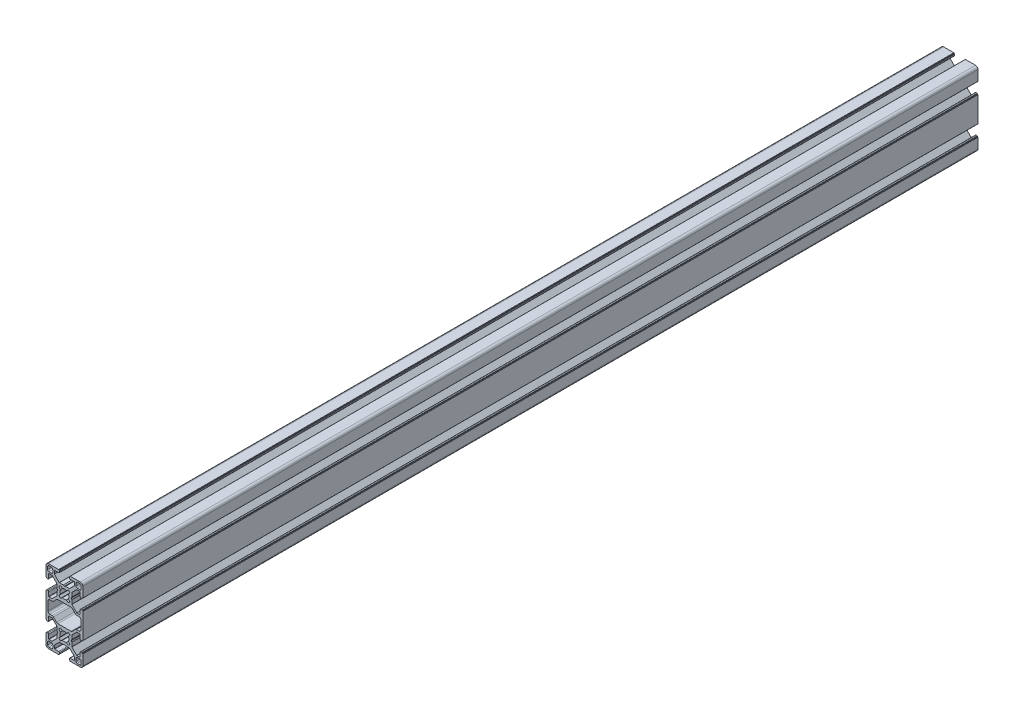
from build123d import *

# Parameters (mm, degrees)
EXTRUDE1_DEPTH = 728.95


with BuildPart() as part:
    # Sketch1 → Extrude1 (new body)
    with BuildSketch(Plane.XY):
        with BuildLine():
            Line((4.117156145, -21), (0.899999648, -21))
            Line((0.899999648, -21), (0.101934004, -20.53923672))
            ThreePointArc((0.101934004, -20.53923672), (0, -20.511923593), (-0.101934004, -20.53923672))
            Line((-0.101934004, -20.53923672), (-0.899999648, -21))
            Line((-0.899999648, -21), (-4.117156145, -21))
            ThreePointArc((-4.117156145, -21), (-4.193692724, -21.015224069), (-4.258577305, -21.058578552))
            Line((-4.258577305, -21.058578552), (-8.191421308, -24.991421554))
            ThreePointArc((-8.191421308, -24.991421554), (-8.234775894, -25.056306263), (-8.25, -25.132843))
            Line((-8.25, -25.132843), (-8.25, -27.6))
            ThreePointArc((-8.25, -27.6), (-8.191421356, -27.741421356), (-8.05, -27.8))
            Line((-8.05, -27.8), (-4.65, -27.8))
            ThreePointArc((-4.65, -27.8), (-4.225735931, -27.975735931), (-4.05, -28.4))
            Line((-4.05, -28.4), (-4.05, -29.3))
            ThreePointArc((-4.05, -29.3), (-4.108578644, -29.441421356), (-4.25, -29.5))
            Line((-4.25, -29.5), (-4.35, -29.5))
            ThreePointArc((-4.35, -29.5), (-4.491421356, -29.558578644), (-4.55, -29.7))
            Line((-4.55, -29.7), (-4.55, -29.8))
            ThreePointArc((-4.55, -29.8), (-4.608578644, -29.941421356), (-4.75, -30))
            Line((-4.75, -30), (-13, -30))
            ThreePointArc((-13, -30), (-14.414213562, -29.414213562), (-15, -28))
            Line((-15, -28), (-15, -19.750000125))
            ThreePointArc((-15, -19.750000125), (-14.941421356, -19.608578769), (-14.8, -19.550000125))
            Line((-14.8, -19.550000125), (-14.700000334, -19.550000125))
            ThreePointArc((-14.700000334, -19.550000125), (-14.558578978, -19.491421481), (-14.500000334, -19.350000125))
            Line((-14.500000334, -19.350000125), (-14.500000334, -19.25))
            ThreePointArc((-14.500000334, -19.25), (-14.44142169, -19.108578644), (-14.300000334, -19.05))
            Line((-14.300000334, -19.05), (-13.400000821, -19.05))
            ThreePointArc((-13.400000821, -19.05), (-12.975736752, -19.225735931), (-12.800000821, -19.65))
            Line((-12.800000821, -19.65), (-12.800000821, -23.05))
            ThreePointArc((-12.800000821, -23.05), (-12.741422177, -23.191421356), (-12.600000821, -23.25))
            Line((-12.600000821, -23.25), (-10.132842821, -23.25))
            ThreePointArc((-10.132842821, -23.25), (-10.056306123, -23.234775902), (-9.991421447, -23.191421338))
            Line((-9.991421447, -23.191421338), (-6.063045884, -19.263044775))
            ThreePointArc((-6.063045884, -19.263044775), (-6.019691347, -19.198160112), (-6.004467258, -19.121623437))
            Line((-6.004467258, -19.121623437), (-6.004467258, -15.90000009))
            Line((-6.004467258, -15.90000009), (-5.542586948, -15.099999736))
            ThreePointArc((-5.542586948, -15.099999736), (-5.515792105, -15), (-5.542586948, -14.900000264))
            Line((-5.542586948, -14.900000264), (-6.004467258, -14.09999991))
            Line((-6.004467258, -14.09999991), (-6.004467258, -10.878376563))
            ThreePointArc((-6.004467258, -10.878376563), (-6.019691347, -10.801839888), (-6.063045884, -10.736955225))
            Line((-6.063045884, -10.736955225), (-9.991421447, -6.808578662))
            ThreePointArc((-9.991421447, -6.808578662), (-10.056306123, -6.765224098), (-10.132842821, -6.75))
            Line((-10.132842821, -6.75), (-12.600000821, -6.75))
            ThreePointArc((-12.600000821, -6.75), (-12.741422177, -6.808578644), (-12.800000821, -6.95))
            Line((-12.800000821, -6.95), (-12.800000821, -10.35))
            ThreePointArc((-12.800000821, -10.35), (-12.975736752, -10.774264069), (-13.400000821, -10.95))
            Line((-13.400000821, -10.95), (-14.300000334, -10.95))
            ThreePointArc((-14.300000334, -10.95), (-14.44142169, -10.891421356), (-14.500000334, -10.75))
            Line((-14.500000334, -10.75), (-14.500000334, -10.65))
            ThreePointArc((-14.500000334, -10.65), (-14.558578978, -10.508578644), (-14.700000334, -10.45))
            Line((-14.700000334, -10.45), (-14.8, -10.45))
            ThreePointArc((-14.8, -10.45), (-14.941421356, -10.391421356), (-15, -10.25))
            Line((-15, -10.25), (-15, 10.25))
            ThreePointArc((-15, 10.25), (-14.941421356, 10.391421356), (-14.8, 10.45))
            Line((-14.8, 10.45), (-14.700000334, 10.45))
            ThreePointArc((-14.700000334, 10.45), (-14.558578978, 10.508578644), (-14.500000334, 10.65))
            Line((-14.500000334, 10.65), (-14.500000334, 10.75))
            ThreePointArc((-14.500000334, 10.75), (-14.44142169, 10.891421356), (-14.300000334, 10.95))
            Line((-14.300000334, 10.95), (-13.400000821, 10.95))
            ThreePointArc((-13.400000821, 10.95), (-12.975736752, 10.774264069), (-12.800000821, 10.35))
            Line((-12.800000821, 10.35), (-12.800000821, 6.95))
            ThreePointArc((-12.800000821, 6.95), (-12.741422177, 6.808578644), (-12.600000821, 6.75))
            Line((-12.600000821, 6.75), (-10.132842821, 6.75))
            ThreePointArc((-10.132842821, 6.75), (-10.056306123, 6.765224098), (-9.991421447, 6.808578662))
            Line((-9.991421447, 6.808578662), (-6.063045884, 10.736955225))
            ThreePointArc((-6.063045884, 10.736955225), (-6.019691347, 10.801839888), (-6.004467258, 10.878376563))
            Line((-6.004467258, 10.878376563), (-6.004467258, 14.09999991))
            Line((-6.004467258, 14.09999991), (-5.542586948, 14.900000264))
            ThreePointArc((-5.542586948, 14.900000264), (-5.515792105, 15), (-5.542586948, 15.099999736))
            Line((-5.542586948, 15.099999736), (-6.004467258, 15.90000009))
            Line((-6.004467258, 15.90000009), (-6.004467258, 19.121623437))
            ThreePointArc((-6.004467258, 19.121623437), (-6.019691347, 19.198160112), (-6.063045884, 19.263044775))
            Line((-6.063045884, 19.263044775), (-9.991421447, 23.191421338))
            ThreePointArc((-9.991421447, 23.191421338), (-10.056306123, 23.234775902), (-10.132842821, 23.25))
            Line((-10.132842821, 23.25), (-12.600000821, 23.25))
            ThreePointArc((-12.600000821, 23.25), (-12.741422177, 23.191421356), (-12.800000821, 23.05))
            Line((-12.800000821, 23.05), (-12.800000821, 19.65))
            ThreePointArc((-12.800000821, 19.65), (-12.975736752, 19.225735931), (-13.400000821, 19.05))
            Line((-13.400000821, 19.05), (-14.300000334, 19.05))
            ThreePointArc((-14.300000334, 19.05), (-14.44142169, 19.108578644), (-14.500000334, 19.25))
            Line((-14.500000334, 19.25), (-14.500000334, 19.350000125))
            ThreePointArc((-14.500000334, 19.350000125), (-14.558578978, 19.491421481), (-14.700000334, 19.550000125))
            Line((-14.700000334, 19.550000125), (-14.8, 19.550000125))
            ThreePointArc((-14.8, 19.550000125), (-14.941421356, 19.608578769), (-15, 19.750000125))
            Line((-15, 19.750000125), (-15, 28))
            ThreePointArc((-15, 28), (-14.414213562, 29.414213562), (-13, 30))
            Line((-13, 30), (-4.75, 30))
            ThreePointArc((-4.75, 30), (-4.608578644, 29.941421356), (-4.55, 29.8))
            Line((-4.55, 29.8), (-4.55, 29.7))
            ThreePointArc((-4.55, 29.7), (-4.491421356, 29.558578644), (-4.35, 29.5))
            Line((-4.35, 29.5), (-4.25, 29.5))
            ThreePointArc((-4.25, 29.5), (-4.108578644, 29.441421356), (-4.05, 29.3))
            Line((-4.05, 29.3), (-4.05, 28.4))
            ThreePointArc((-4.05, 28.4), (-4.225735931, 27.975735931), (-4.65, 27.8))
            Line((-4.65, 27.8), (-8.05, 27.8))
            ThreePointArc((-8.05, 27.8), (-8.191421356, 27.741421356), (-8.25, 27.6))
            Line((-8.25, 27.6), (-8.25, 25.132843))
            ThreePointArc((-8.25, 25.132843), (-8.234775894, 25.056306263), (-8.191421308, 24.991421554))
            Line((-8.191421308, 24.991421554), (-4.258577305, 21.058578552))
            ThreePointArc((-4.258577305, 21.058578552), (-4.193692724, 21.015224069), (-4.117156145, 21))
            Line((-4.117156145, 21), (-0.899999648, 21))
            Line((-0.899999648, 21), (-0.101934004, 20.53923672))
            ThreePointArc((-0.101934004, 20.53923672), (0, 20.511923593), (0.101934004, 20.53923672))
            Line((0.101934004, 20.53923672), (0.899999648, 21))
            Line((0.899999648, 21), (4.117156145, 21))
            ThreePointArc((4.117156145, 21), (4.193692724, 21.015224069), (4.258577305, 21.058578552))
            Line((4.258577305, 21.058578552), (8.191421308, 24.991421554))
            ThreePointArc((8.191421308, 24.991421554), (8.234775894, 25.056306263), (8.25, 25.132843))
            Line((8.25, 25.132843), (8.25, 27.6))
            ThreePointArc((8.25, 27.6), (8.191421356, 27.741421356), (8.05, 27.8))
            Line((8.05, 27.8), (4.65, 27.8))
            ThreePointArc((4.65, 27.8), (4.225735931, 27.975735931), (4.05, 28.4))
            Line((4.05, 28.4), (4.05, 29.3))
            ThreePointArc((4.05, 29.3), (4.108578644, 29.441421356), (4.25, 29.5))
            Line((4.25, 29.5), (4.35, 29.5))
            ThreePointArc((4.35, 29.5), (4.491421356, 29.558578644), (4.55, 29.7))
            Line((4.55, 29.7), (4.55, 29.8))
            ThreePointArc((4.55, 29.8), (4.608578644, 29.941421356), (4.75, 30))
            Line((4.75, 30), (13, 30))
            ThreePointArc((13, 30), (14.414213562, 29.414213562), (15, 28))
            Line((15, 28), (15, 19.750000125))
            ThreePointArc((15, 19.750000125), (14.941421356, 19.608578769), (14.8, 19.550000125))
            Line((14.8, 19.550000125), (14.700000334, 19.550000125))
            ThreePointArc((14.700000334, 19.550000125), (14.558578978, 19.491421481), (14.500000334, 19.350000125))
            Line((14.500000334, 19.350000125), (14.500000334, 19.25))
            ThreePointArc((14.500000334, 19.25), (14.44142169, 19.108578644), (14.300000334, 19.05))
            Line((14.300000334, 19.05), (13.400000821, 19.05))
            ThreePointArc((13.400000821, 19.05), (12.975736752, 19.225735931), (12.800000821, 19.65))
            Line((12.800000821, 19.65), (12.800000821, 23.05))
            ThreePointArc((12.800000821, 23.05), (12.741422177, 23.191421356), (12.600000821, 23.25))
            Line((12.600000821, 23.25), (10.132842821, 23.25))
            ThreePointArc((10.132842821, 23.25), (10.056306123, 23.234775902), (9.991421447, 23.191421338))
            Line((9.991421447, 23.191421338), (6.063045884, 19.263044775))
            ThreePointArc((6.063045884, 19.263044775), (6.019691347, 19.198160112), (6.004467258, 19.121623437))
            Line((6.004467258, 19.121623437), (6.004467258, 15.90000009))
            Line((6.004467258, 15.90000009), (5.542586948, 15.099999736))
            ThreePointArc((5.542586948, 15.099999736), (5.515792105, 15), (5.542586948, 14.900000264))
            Line((5.542586948, 14.900000264), (6.004467258, 14.09999991))
            Line((6.004467258, 14.09999991), (6.004467258, 10.878376563))
            ThreePointArc((6.004467258, 10.878376563), (6.019691347, 10.801839888), (6.063045884, 10.736955225))
            Line((6.063045884, 10.736955225), (9.991421447, 6.808578662))
            ThreePointArc((9.991421447, 6.808578662), (10.056306123, 6.765224098), (10.132842821, 6.75))
            Line((10.132842821, 6.75), (12.600000821, 6.75))
            ThreePointArc((12.600000821, 6.75), (12.741422177, 6.808578644), (12.800000821, 6.95))
            Line((12.800000821, 6.95), (12.800000821, 10.35))
            ThreePointArc((12.800000821, 10.35), (12.975736752, 10.774264069), (13.400000821, 10.95))
            Line((13.400000821, 10.95), (14.300000334, 10.95))
            ThreePointArc((14.300000334, 10.95), (14.44142169, 10.891421356), (14.500000334, 10.75))
            Line((14.500000334, 10.75), (14.500000334, 10.65))
            ThreePointArc((14.500000334, 10.65), (14.558578978, 10.508578644), (14.700000334, 10.45))
            Line((14.700000334, 10.45), (14.8, 10.45))
            ThreePointArc((14.8, 10.45), (14.941421356, 10.391421356), (15, 10.25))
            Line((15, 10.25), (15, -10.25))
            ThreePointArc((15, -10.25), (14.941421356, -10.391421356), (14.8, -10.45))
            Line((14.8, -10.45), (14.700000334, -10.45))
            ThreePointArc((14.700000334, -10.45), (14.558578978, -10.508578644), (14.500000334, -10.65))
            Line((14.500000334, -10.65), (14.500000334, -10.75))
            ThreePointArc((14.500000334, -10.75), (14.44142169, -10.891421356), (14.300000334, -10.95))
            Line((14.300000334, -10.95), (13.400000821, -10.95))
            ThreePointArc((13.400000821, -10.95), (12.975736752, -10.774264069), (12.800000821, -10.35))
            Line((12.800000821, -10.35), (12.800000821, -6.95))
            ThreePointArc((12.800000821, -6.95), (12.741422177, -6.808578644), (12.600000821, -6.75))
            Line((12.600000821, -6.75), (10.132842821, -6.75))
            ThreePointArc((10.132842821, -6.75), (10.056306123, -6.765224098), (9.991421447, -6.808578662))
            Line((9.991421447, -6.808578662), (6.063045884, -10.736955225))
            ThreePointArc((6.063045884, -10.736955225), (6.019691347, -10.801839888), (6.004467258, -10.878376563))
            Line((6.004467258, -10.878376563), (6.004467258, -14.09999991))
            Line((6.004467258, -14.09999991), (5.542586948, -14.900000264))
            ThreePointArc((5.542586948, -14.900000264), (5.515792105, -15), (5.542586948, -15.099999736))
            Line((5.542586948, -15.099999736), (6.004467258, -15.90000009))
            Line((6.004467258, -15.90000009), (6.004467258, -19.121623437))
            ThreePointArc((6.004467258, -19.121623437), (6.019691347, -19.198160112), (6.063045884, -19.263044775))
            Line((6.063045884, -19.263044775), (9.991421447, -23.191421338))
            ThreePointArc((9.991421447, -23.191421338), (10.056306123, -23.234775902), (10.132842821, -23.25))
            Line((10.132842821, -23.25), (12.600000821, -23.25))
            ThreePointArc((12.600000821, -23.25), (12.741422177, -23.191421356), (12.800000821, -23.05))
            Line((12.800000821, -23.05), (12.800000821, -19.65))
            ThreePointArc((12.800000821, -19.65), (12.975736752, -19.225735931), (13.400000821, -19.05))
            Line((13.400000821, -19.05), (14.300000334, -19.05))
            ThreePointArc((14.300000334, -19.05), (14.44142169, -19.108578644), (14.500000334, -19.25))
            Line((14.500000334, -19.25), (14.500000334, -19.350000125))
            ThreePointArc((14.500000334, -19.350000125), (14.558578978, -19.491421481), (14.700000334, -19.550000125))
            Line((14.700000334, -19.550000125), (14.8, -19.550000125))
            ThreePointArc((14.8, -19.550000125), (14.941421356, -19.608578769), (15, -19.750000125))
            Line((15, -19.750000125), (15, -28))
            ThreePointArc((15, -28), (14.414213562, -29.414213562), (13, -30))
            Line((13, -30), (4.75, -30))
            ThreePointArc((4.75, -30), (4.608578644, -29.941421356), (4.55, -29.8))
            Line((4.55, -29.8), (4.55, -29.7))
            ThreePointArc((4.55, -29.7), (4.491421356, -29.558578644), (4.35, -29.5))
            Line((4.35, -29.5), (4.25, -29.5))
            ThreePointArc((4.25, -29.5), (4.108578644, -29.441421356), (4.05, -29.3))
            Line((4.05, -29.3), (4.05, -28.4))
            ThreePointArc((4.05, -28.4), (4.225735931, -27.975735931), (4.65, -27.8))
            Line((4.65, -27.8), (8.05, -27.8))
            ThreePointArc((8.05, -27.8), (8.191421356, -27.741421356), (8.25, -27.6))
            Line((8.25, -27.6), (8.25, -25.132843))
            ThreePointArc((8.25, -25.132843), (8.234775894, -25.056306263), (8.191421308, -24.991421554))
            Line((8.191421308, -24.991421554), (4.258577305, -21.058578552))
            ThreePointArc((4.258577305, -21.058578552), (4.193692724, -21.015224069), (4.117156145, -21))
        make_face()
        with BuildLine():
            Line((1.600130621, -18.280561232), (3.154670945, -19.505335862))
            ThreePointArc((3.154670945, -19.505335862), (3.897156783, -18.881001031), (4.518401855, -18.135928041))
            Line((4.518401855, -18.135928041), (3.28056155, -16.600129968))
            ThreePointArc((3.28056155, -16.600129968), (3.65, -15), (3.28056155, -13.399870032))
            Line((3.28056155, -13.399870032), (4.518401855, -11.864071959))
            ThreePointArc((4.518401855, -11.864071959), (3.897156783, -11.118998969), (3.154670945, -10.494664138))
            Line((3.154670945, -10.494664138), (1.600130621, -11.719438768))
            ThreePointArc((1.600130621, -11.719438768), (0, -11.35), (-1.600130621, -11.719438768))
            Line((-1.600130621, -11.719438768), (-3.154670945, -10.494664138))
            ThreePointArc((-3.154670945, -10.494664138), (-3.897156783, -11.118998969), (-4.518401855, -11.864071959))
            Line((-4.518401855, -11.864071959), (-3.28056155, -13.399870032))
            ThreePointArc((-3.28056155, -13.399870032), (-3.65, -15), (-3.28056155, -16.600129968))
            Line((-3.28056155, -16.600129968), (-4.518401855, -18.135928041))
            ThreePointArc((-4.518401855, -18.135928041), (-3.897156783, -18.881001031), (-3.154670945, -19.505335862))
            Line((-3.154670945, -19.505335862), (-1.600130621, -18.280561232))
            ThreePointArc((-1.600130621, -18.280561232), (0, -18.65), (1.600130621, -18.280561232))
        make_face(mode=Mode.SUBTRACT)
        with BuildLine():
            Line((10.500000904, -24.500000174), (12.700000904, -24.500000174))
            ThreePointArc((12.700000904, -24.500000174), (13.407107685, -24.792893393), (13.700000904, -25.500000174))
            Line((13.700000904, -25.500000174), (13.700000904, -27.700000174))
            ThreePointArc((13.700000904, -27.700000174), (13.407107685, -28.407106955), (12.700000904, -28.700000174))
            Line((12.700000904, -28.700000174), (10.500000904, -28.700000174))
            ThreePointArc((10.500000904, -28.700000174), (9.792894123, -28.407106955), (9.500000904, -27.700000174))
            Line((9.500000904, -27.700000174), (9.500000904, -25.500000174))
            ThreePointArc((9.500000904, -25.500000174), (9.792894123, -24.792893393), (10.500000904, -24.500000174))
        make_face(mode=Mode.SUBTRACT)
        with BuildLine():
            Line((8.927207818, -5.539339793), (6.410354008, -8.056193946))
            ThreePointArc((6.410354008, -8.056193946), (5.923718991, -8.381353081), (5.349693844, -8.495533793))
            Line((5.349693844, -8.495533793), (-5.349693844, -8.495533793))
            ThreePointArc((-5.349693844, -8.495533793), (-5.923718991, -8.381353081), (-6.410354008, -8.056193946))
            Line((-6.410354008, -8.056193946), (-8.927207818, -5.539339793))
            ThreePointArc((-8.927207818, -5.539339793), (-9.413842802, -5.214180692), (-9.987867904, -5.1))
            Line((-9.987867904, -5.1), (-11.849999904, -5.1))
            ThreePointArc((-11.849999904, -5.1), (-12.910660076, -4.660660172), (-13.349999904, -3.6))
            Line((-13.349999904, -3.6), (-13.349999904, 3.6))
            ThreePointArc((-13.349999904, 3.6), (-12.910660076, 4.660660172), (-11.849999904, 5.1))
            Line((-11.849999904, 5.1), (-9.987867904, 5.1))
            ThreePointArc((-9.987867904, 5.1), (-9.413842802, 5.214180692), (-8.927207818, 5.539339793))
            Line((-8.927207818, 5.539339793), (-6.410354008, 8.056193946))
            ThreePointArc((-6.410354008, 8.056193946), (-5.923718991, 8.381353081), (-5.349693844, 8.495533793))
            Line((-5.349693844, 8.495533793), (5.349693844, 8.495533793))
            ThreePointArc((5.349693844, 8.495533793), (5.923718991, 8.381353081), (6.410354008, 8.056193946))
            Line((6.410354008, 8.056193946), (8.927207818, 5.539339793))
            ThreePointArc((8.927207818, 5.539339793), (9.413842802, 5.214180692), (9.987867904, 5.1))
            Line((9.987867904, 5.1), (11.849999904, 5.1))
            ThreePointArc((11.849999904, 5.1), (12.910660076, 4.660660172), (13.349999904, 3.6))
            Line((13.349999904, 3.6), (13.349999904, -3.6))
            ThreePointArc((13.349999904, -3.6), (12.910660076, -4.660660172), (11.849999904, -5.1))
            Line((11.849999904, -5.1), (9.987867904, -5.1))
            ThreePointArc((9.987867904, -5.1), (9.413842802, -5.214180692), (8.927207818, -5.539339793))
        make_face(mode=Mode.SUBTRACT)
        with BuildLine():
            Line((-1.600130621, 18.280561232), (-3.154670945, 19.505335862))
            ThreePointArc((-3.154670945, 19.505335862), (-3.897156783, 18.881001031), (-4.518401855, 18.135928041))
            Line((-4.518401855, 18.135928041), (-3.28056155, 16.600129968))
            ThreePointArc((-3.28056155, 16.600129968), (-3.65, 15), (-3.28056155, 13.399870032))
            Line((-3.28056155, 13.399870032), (-4.518401855, 11.864071959))
            ThreePointArc((-4.518401855, 11.864071959), (-3.897156783, 11.118998969), (-3.154670945, 10.494664138))
            Line((-3.154670945, 10.494664138), (-1.600130621, 11.719438768))
            ThreePointArc((-1.600130621, 11.719438768), (0, 11.35), (1.600130621, 11.719438768))
            Line((1.600130621, 11.719438768), (3.154670945, 10.494664138))
            ThreePointArc((3.154670945, 10.494664138), (3.897156783, 11.118998969), (4.518401855, 11.864071959))
            Line((4.518401855, 11.864071959), (3.28056155, 13.399870032))
            ThreePointArc((3.28056155, 13.399870032), (3.65, 15), (3.28056155, 16.600129968))
            Line((3.28056155, 16.600129968), (4.518401855, 18.135928041))
            ThreePointArc((4.518401855, 18.135928041), (3.897156783, 18.881001031), (3.154670945, 19.505335862))
            Line((3.154670945, 19.505335862), (1.600130621, 18.280561232))
            ThreePointArc((1.600130621, 18.280561232), (0, 18.65), (-1.600130621, 18.280561232))
        make_face(mode=Mode.SUBTRACT)
        with BuildLine():
            Line((-10.500000904, 24.500000174), (-12.700000904, 24.500000174))
            ThreePointArc((-12.700000904, 24.500000174), (-13.407107685, 24.792893393), (-13.700000904, 25.500000174))
            Line((-13.700000904, 25.500000174), (-13.700000904, 27.700000174))
            ThreePointArc((-13.700000904, 27.700000174), (-13.407107685, 28.407106955), (-12.700000904, 28.700000174))
            Line((-12.700000904, 28.700000174), (-10.500000904, 28.700000174))
            ThreePointArc((-10.500000904, 28.700000174), (-9.792894123, 28.407106955), (-9.500000904, 27.700000174))
            Line((-9.500000904, 27.700000174), (-9.500000904, 25.500000174))
            ThreePointArc((-9.500000904, 25.500000174), (-9.792894123, 24.792893393), (-10.500000904, 24.500000174))
        make_face(mode=Mode.SUBTRACT)
        with BuildLine():
            Line((9.500000904, 27.700000174), (9.500000904, 25.500000174))
            ThreePointArc((9.500000904, 25.500000174), (9.792894123, 24.792893393), (10.500000904, 24.500000174))
            Line((10.500000904, 24.500000174), (12.700000904, 24.500000174))
            ThreePointArc((12.700000904, 24.500000174), (13.407107685, 24.792893393), (13.700000904, 25.500000174))
            Line((13.700000904, 25.500000174), (13.700000904, 27.700000174))
            ThreePointArc((13.700000904, 27.700000174), (13.407107685, 28.407106955), (12.700000904, 28.700000174))
            Line((12.700000904, 28.700000174), (10.500000904, 28.700000174))
            ThreePointArc((10.500000904, 28.700000174), (9.792894123, 28.407106955), (9.500000904, 27.700000174))
        make_face(mode=Mode.SUBTRACT)
        with BuildLine():
            Line((-9.500000904, -27.700000174), (-9.500000904, -25.500000174))
            ThreePointArc((-9.500000904, -25.500000174), (-9.792894123, -24.792893393), (-10.500000904, -24.500000174))
            Line((-10.500000904, -24.500000174), (-12.700000904, -24.500000174))
            ThreePointArc((-12.700000904, -24.500000174), (-13.407107685, -24.792893393), (-13.700000904, -25.500000174))
            Line((-13.700000904, -25.500000174), (-13.700000904, -27.700000174))
            ThreePointArc((-13.700000904, -27.700000174), (-13.407107685, -28.407106955), (-12.700000904, -28.700000174))
            Line((-12.700000904, -28.700000174), (-10.500000904, -28.700000174))
            ThreePointArc((-10.500000904, -28.700000174), (-9.792894123, -28.407106955), (-9.500000904, -27.700000174))
        make_face(mode=Mode.SUBTRACT)
    extrude(amount=EXTRUDE1_DEPTH)


solid = part.part
